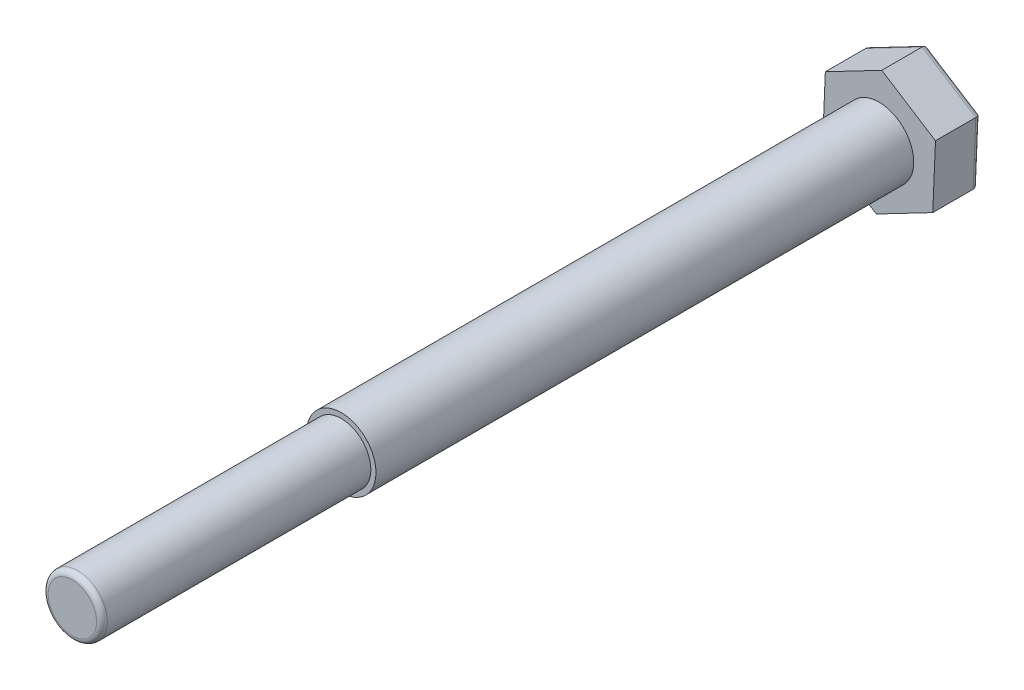
from build123d import *

# Parameters (mm, degrees)
EXTRUDE_376_DEPTH = 17
SKETCH_2_R        = 12.9
EXTRUDE_1_DEPTH   = 200
FILLET_3_R        = 2
SKETCH_3_R        = 11
EXTRUDE_2_DEPTH   = 100
FILLET_4_R        = 2


with BuildPart() as part:
    # 草图1 → Extrude 376 (new body)
    with BuildSketch(Plane.XY):
        Polygon((20.984201837, 10.954296262), (1.005402075, 23.65), (-19.978799762, 12.695703738), (-20.984201837, -10.954296262), (-1.005402075, -23.65), (19.978799762, -12.695703738), align=None)
    extrude(amount=EXTRUDE_376_DEPTH)

    # 草图2 → 凸台-拉伸1 (add)
    with BuildSketch(Plane.XY.offset(17)):
        with Locations(Location((0, 0, 0), (0, 0, 180))):
            Circle(SKETCH_2_R)
    extrude(amount=EXTRUDE_1_DEPTH)

    # 圆角3
    fillet_3_edges = [part.edges().sort_by_distance(p)[0] for p in [
        (9.486698843, -18.172851869, 0),
        (-10.994801956, -17.302148131, 0),
        (-20.4815008, 0.870703738, 0),
        (-9.486698843, 18.172851869, 0),
        (10.994801956, 17.302148131, 0),
        (20.4815008, -0.870703738, 0),
    ]]
    fillet(fillet_3_edges, radius=FILLET_3_R)

    # 草图3 → 凸台-拉伸2 (add)
    with BuildSketch(Plane.XY.offset(217)):
        Circle(SKETCH_3_R)
    extrude(amount=EXTRUDE_2_DEPTH)

    # 圆角4
    fillet_4_edges = [part.edges().sort_by_distance(p)[0] for p in [
        (-11, 0, 317),
    ]]
    fillet(fillet_4_edges, radius=FILLET_4_R)


solid = part.part
